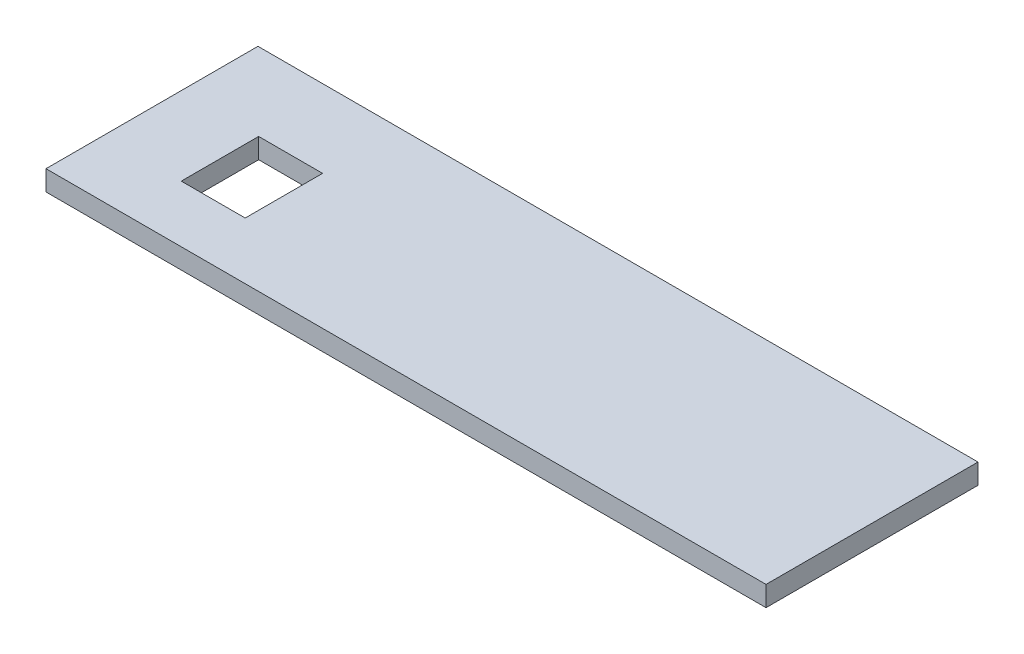
from build123d import *

# Parameters (mm, degrees)
SKETCH_1_W      = 107
SKETCH_1_H      = 31.5
SKETCH_1_W_2    = 9.5
SKETCH_1_H_2    = 11.5
EXTRUDE_1_DEPTH = 3


with BuildPart() as part:
    # Эскиз1 → Бобышка-Вытянуть1 (new body)
    with BuildSketch(Plane(origin=(0, 0, 0), x_dir=(1, 0, 0), z_dir=(0, 1, 0))):
        with Locations((53.5, -15.75)):
            Rectangle(SKETCH_1_W, SKETCH_1_H)
        with Locations((16.4, -17.3)):
            Rectangle(SKETCH_1_W_2, SKETCH_1_H_2, mode=Mode.SUBTRACT)
    extrude(amount=EXTRUDE_1_DEPTH)


solid = part.part
